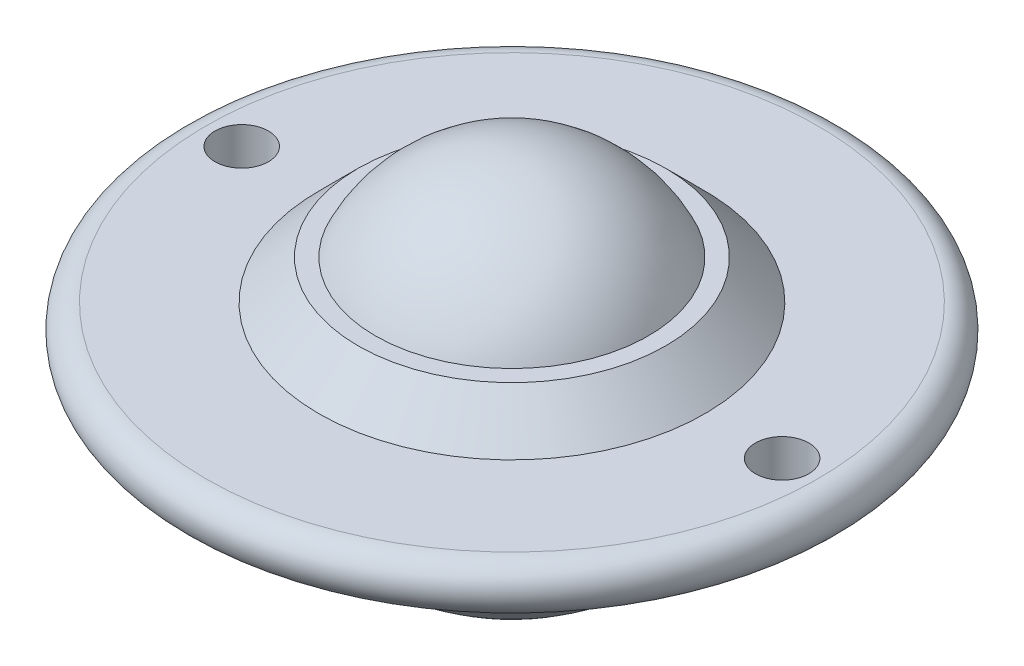
from build123d import *

# Parameters (mm, degrees)
SKETCH_2_R          = 2.25
CUT_EXTRUDE_1_DEPTH = 43.085211311


with BuildPart() as part:
    # ｽｹｯﾁ1 → 回転1 (revolve)
    with BuildSketch(Plane.XY, mode=Mode.PRIVATE) as revolve_1_sk:
        with BuildLine():
            Line((-25.75, 2), (-16.25, 2))
            Line((-16.25, 2), (-12.95, 5.3))
            Line((-12.95, 5.3), (-11.494781425, 5.3))
            ThreePointArc((-11.494781425, 5.3), (-6.808450631, 10.620774226), (0, 12.6))
            Line((0, 12.6), (0, -17.2))
            ThreePointArc((0, -17.2), (-11.532562595, -12.862446581), (-17.348198754, -2))
            Line((-17.348198754, -2), (-25.75, -2))
            ThreePointArc((-25.75, -2), (-27.75, 0), (-25.75, 2))
        make_face()
    revolve(revolve_1_sk.sketch.rotate(Axis((0, 0, 0), (0, -1, 0)), 270), axis=Axis((0, 0, 0), (0, -1, 0)))

    # ｽｹｯﾁ2 → ｶｯﾄ - 押し出し1 (cut, through all)
    with BuildSketch(Plane.XZ.offset(2)):
        with Locations(Location((-22.75, 0, 0), (0, 0, 270))):
            Circle(SKETCH_2_R)
        with Locations(Location((22.75, 0, 0), (0, 0, 90))):
            Circle(SKETCH_2_R)
    extrude(amount=-CUT_EXTRUDE_1_DEPTH, mode=Mode.SUBTRACT)


solid = part.part
